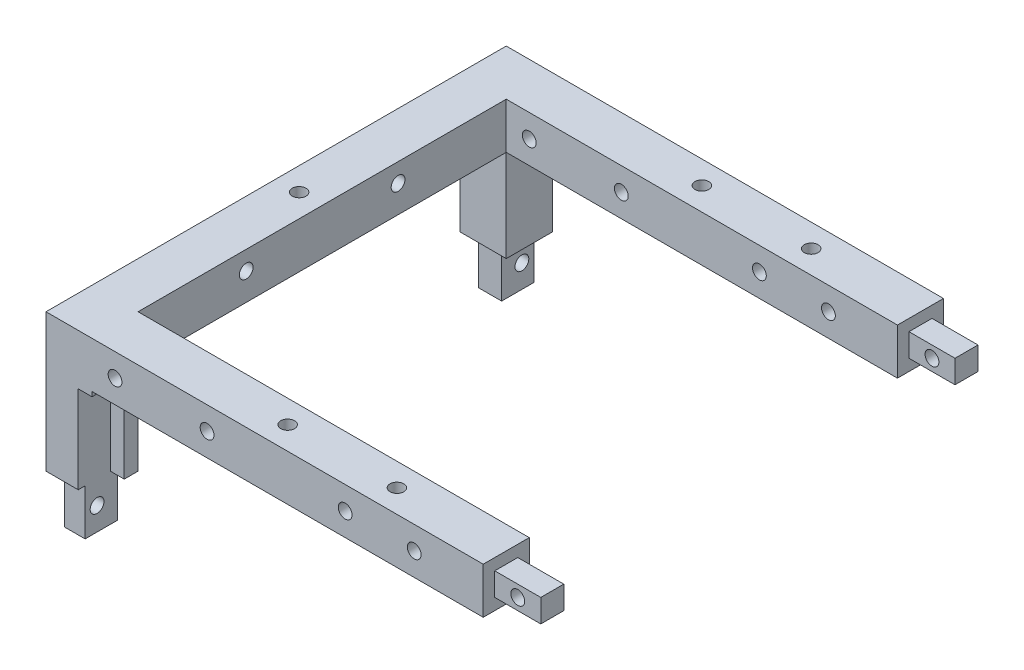
from build123d import *

# Parameters (mm, degrees)
SKETCH1_W               = 320
SKETCH1_H               = 200
SKETCH1_W_2             = 280
SKETCH1_H_2             = 160
BOSS_EXTRUDE1_DEPTH     = 20
SKETCH2_W               = 130
SKETCH2_H               = 200
CUT_EXTRUDE1_DEPTH      = 20
SKETCH5_W               = 20
SKETCH5_H               = 20
BOSS_EXTRUDE4_DEPTH     = 40
SKETCH8_W               = 10
SKETCH8_H               = 14
BOSS_EXTRUDE5_DEPTH     = 20
SKETCH9_W               = 10
SKETCH9_H               = 14
BOSS_EXTRUDE6_DEPTH     = 20
SKETCH10_W              = 10
SKETCH10_H              = 10
BOSS_EXTRUDE7_DEPTH     = 20
SKETCH11_R              = 3
CUT_EXTRUDE2_DEPTH      = 30
SKETCH13_R              = 3
CUT_EXTRUDE3_DEPTH      = 30
CUT_EXTRUDE4_DEPTH      = 297.141857899
CUT_EXTRUDE4_DEPTH_BACK = 297.141857899
SKETCH14_R              = 3
CUT_EXTRUDE5_DEPTH      = 293.788319439
CUT_EXTRUDE5_DEPTH_BACK = 293.788319439
SKETCH16_R              = 3
SKETCH17_W              = 14
SKETCH17_H              = 38
CUT_EXTRUDE6_DEPTH      = 5
CUT_EXTRUDE7_DEPTH      = 1


with BuildPart() as part:
    # Sketch1 → Boss-Extrude1 (new body)
    with BuildSketch(Plane(origin=(0, 0, 0), x_dir=(1, 0, 0), z_dir=(0, 1, 0))):
        with Locations((160, 100)):
            Rectangle(SKETCH1_W, SKETCH1_H)
        with Locations((160, 100)):
            Rectangle(SKETCH1_W_2, SKETCH1_H_2, mode=Mode.SUBTRACT)
    extrude(amount=BOSS_EXTRUDE1_DEPTH)

    # Sketch2 → Cut-Extrude1 (cut)
    with BuildSketch(Plane(origin=(0, 20, 0), x_dir=(1, 0, 0), z_dir=(0, 1, 0))):
        with Locations((255, 100)):
            Rectangle(SKETCH2_W, SKETCH2_H)
    extrude(amount=-CUT_EXTRUDE1_DEPTH, mode=Mode.SUBTRACT)

    # Sketch5 → Boss-Extrude4 (add)
    with BuildSketch(Plane.XZ):
        with Locations((10, -10)):
            Rectangle(SKETCH5_W, SKETCH5_H)
        with Locations((10, -190)):
            Rectangle(SKETCH5_W, SKETCH5_H)
    extrude(amount=BOSS_EXTRUDE4_DEPTH)

    # Sketch8 → Boss-Extrude5 (add)
    with BuildSketch(Plane.XZ.offset(40)):
        with Locations((10, -10)):
            Rectangle(SKETCH8_W, SKETCH8_H)
    extrude(amount=BOSS_EXTRUDE5_DEPTH)

    # Sketch9 → Boss-Extrude6 (add)
    with BuildSketch(Plane.XZ.offset(40)):
        with Locations((10, -190)):
            Rectangle(SKETCH9_W, SKETCH9_H)
    extrude(amount=BOSS_EXTRUDE6_DEPTH)

    # Sketch10 → Boss-Extrude7 (add)
    with BuildSketch(Plane(origin=(190, 0, 0), x_dir=(0, 0, -1), z_dir=(1, 0, 0))):
        with Locations((190, 10)):
            Rectangle(SKETCH10_W, SKETCH10_H)
        with Locations((10, 10)):
            Rectangle(SKETCH10_W, SKETCH10_H)
    extrude(amount=BOSS_EXTRUDE7_DEPTH)

    # Sketch11 → Cut-Extrude2 (cut)
    with BuildSketch(Plane(origin=(0, 20, 0), x_dir=(1, 0, 0), z_dir=(0, 1, 0))):
        with Locations(Location((142.5, 190, 0), (0, 0, 270))):
            Circle(SKETCH11_R)
        with Locations(Location((95, 190, 0), (0, 0, 270))):
            Circle(SKETCH11_R)
        with Locations(Location((10, 100, 0), (0, 0, 270))):
            Circle(SKETCH11_R)
        with Locations(Location((142.5, 10, 0), (0, 0, 90))):
            Circle(SKETCH11_R)
        with Locations(Location((95, 10, 0), (0, 0, 90))):
            Circle(SKETCH11_R)
    extrude(amount=-CUT_EXTRUDE2_DEPTH, mode=Mode.SUBTRACT)

    # Sketch13 → Cut-Extrude3 (cut)
    with BuildSketch(Plane.ZY):
        with Locations((-8.2, -50)):
            Circle(SKETCH13_R)
        with Locations((-67, 11.8)):
            Circle(SKETCH13_R)
        with Locations((-133, 11.8)):
            Circle(SKETCH13_R)
        with Locations((-191.8, -50)):
            Circle(SKETCH13_R)
    extrude(amount=-CUT_EXTRUDE3_DEPTH, mode=Mode.SUBTRACT)

    # Sketch14 → Cut-Extrude4 (cut, two sides: drawn at the far end of the back side and taken through both)
    with BuildSketch(Plane(origin=(0, 0, -200), x_dir=(-1, 0, 0), z_dir=(0, 0, -1)).offset(-CUT_EXTRUDE4_DEPTH_BACK)):
        with Locations((-160, 10)):
            Circle(SKETCH14_R)
        with Locations((-30, 10)):
            Circle(SKETCH14_R)
        with Locations((-130, 10)):
            Circle(SKETCH14_R)
        with Locations((-70, 10)):
            Circle(SKETCH14_R)
    extrude(amount=CUT_EXTRUDE4_DEPTH + CUT_EXTRUDE4_DEPTH_BACK, mode=Mode.SUBTRACT)

    # Sketch16 → Cut-Extrude5 (cut, two sides: drawn at the far end of the back side and taken through both)
    with BuildSketch(Plane.XY.offset(-5).offset(-CUT_EXTRUDE5_DEPTH_BACK)):
        with Locations((200, 10)):
            Circle(SKETCH16_R)
    extrude(amount=CUT_EXTRUDE5_DEPTH + CUT_EXTRUDE5_DEPTH_BACK, mode=Mode.SUBTRACT)

    # Sketch17 → Cut-Extrude6 (cut)
    with BuildSketch(Plane(origin=(20, 0, 0), x_dir=(0, 0, -1), z_dir=(1, 0, 0))):
        with Locations((7, -21)):
            Rectangle(SKETCH17_W, SKETCH17_H)
    extrude(amount=-CUT_EXTRUDE6_DEPTH, mode=Mode.SUBTRACT)

    # Sketch18 → Cut-Extrude7 (cut)
    with BuildSketch(Plane(origin=(15, 0, 0), x_dir=(0, 0, -1), z_dir=(1, 0, 0))):
        Polygon((0, -2), (14, -2), (14, -40), (17, -40), (17, -60), (3, -60), (3, -40), (0, -40), align=None)
    extrude(amount=-CUT_EXTRUDE7_DEPTH, mode=Mode.SUBTRACT)


solid = part.part
